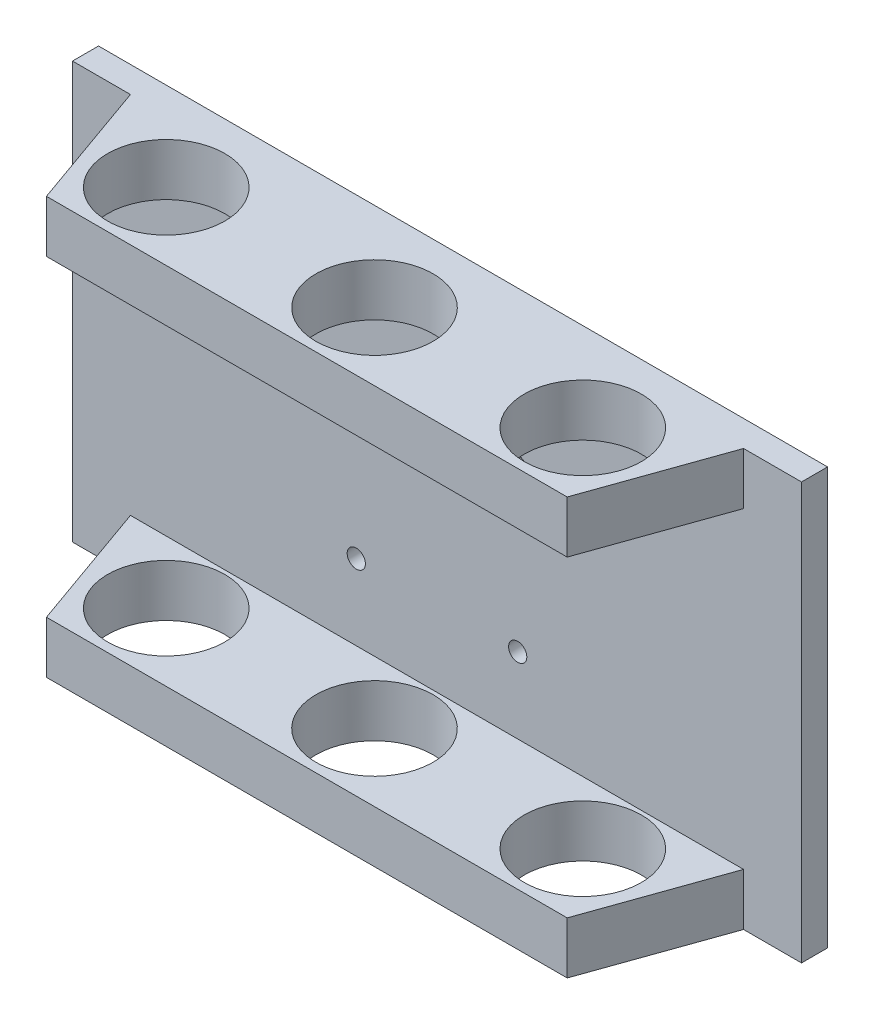
from build123d import *

# Parameters (mm, degrees)
SKETCH_1_R          = 11.25
EXTRUDE_1_DEPTH     = 40
SKETCH_2_W          = 25
SKETCH_2_H          = 60
CUT_EXTRUDE1_DEPTH  = 149.176415127
SKETCH_3_R          = 1.75
CUT_EXTRUDE_1_DEPTH = 10


with BuildPart() as part:
    # Эскиз1 → Бобышка-Вытянуть1 (new, symmetric)
    with BuildSketch(Plane(origin=(0, 0, 0), x_dir=(1, 0, 0), z_dir=(0, 1, 0))):
        Polygon((-70, -2.5), (-58.870442851, -2.5), (-50, -27.5), (50, -27.5), (58.870442851, -2.5), (70, -2.5), (70, 2.5), (-70, 2.5), align=None)
        with Locations(Location((0, -14.5, 0), (0, 0, 270))):
            Circle(SKETCH_1_R, mode=Mode.SUBTRACT)
        with Locations(Location((40, -14.5, 0), (0, 0, 270))):
            Circle(SKETCH_1_R, mode=Mode.SUBTRACT)
        with Locations(Location((-40, -14.5, 0), (0, 0, 90))):
            Circle(SKETCH_1_R, mode=Mode.SUBTRACT)
    extrude(amount=EXTRUDE_1_DEPTH, both=True)

    # Эскиз2 → Cut-Extrude1 (cut, through all)
    with BuildSketch(Plane.ZY.offset(70)):
        with Locations((15, 0)):
            Rectangle(SKETCH_2_W, SKETCH_2_H)
    extrude(amount=-CUT_EXTRUDE1_DEPTH, mode=Mode.SUBTRACT)

    # Эскиз3 → Вырез-Вытянуть1 (cut)
    with BuildSketch(Plane(origin=(0, 0, -2.5), x_dir=(-1, 0, 0), z_dir=(0, 0, -1))):
        with Locations((-15.5, 15.5)):
            Circle(SKETCH_3_R)
        with Locations((15.5, 15.5)):
            Circle(SKETCH_3_R)
        with Locations((15.5, -15.5)):
            Circle(SKETCH_3_R)
        with Locations((-15.5, -15.5)):
            Circle(SKETCH_3_R)
    extrude(amount=-CUT_EXTRUDE_1_DEPTH, mode=Mode.SUBTRACT)


solid = part.part
